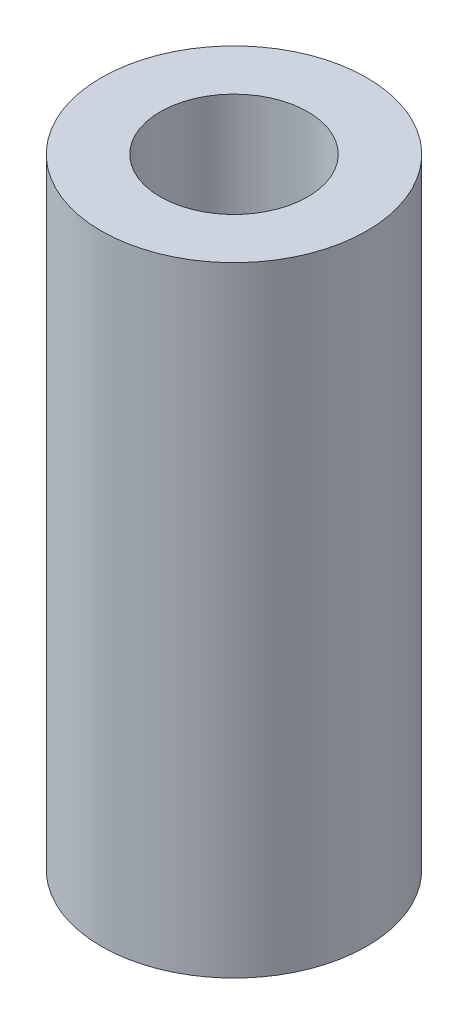
from build123d import *

# Parameters (mm, degrees)
SKETCH1_R           = 2.25
BOSS_EXTRUDE1_DEPTH = 10.5
CUT_EXTRUDE1_REACH  = 12.972
SKETCH2_R           = 1.25


with BuildPart() as part:
    # Sketch1 → Boss-Extrude1 (new body)
    with BuildSketch(Plane(origin=(0, 0, 0), x_dir=(1, 0, 0), z_dir=(0, 1, 0))):
        with Locations(Location((0, 0, 0), (0, 0, 90))):
            Circle(SKETCH1_R)
    extrude(amount=BOSS_EXTRUDE1_DEPTH)

    # Sketch2 → Cut-Extrude1 (cut, up to next)
    with BuildSketch(Plane(origin=(0, 10.5, 0), x_dir=(1, 0, 0), z_dir=(0, 1, 0)), mode=Mode.PRIVATE) as cut_extrude1_sk1:
        with Locations(Location((0, 0, 0), (0, 0, 270))):
            Circle(SKETCH2_R)
    cut_extrude1_tool1 = extrude(cut_extrude1_sk1.sketch, amount=-CUT_EXTRUDE1_REACH, mode=Mode.PRIVATE) & part.part
    add(cut_extrude1_tool1.solids().sort_by_distance((0, 10.5, 0))[0], mode=Mode.SUBTRACT)


solid = part.part
